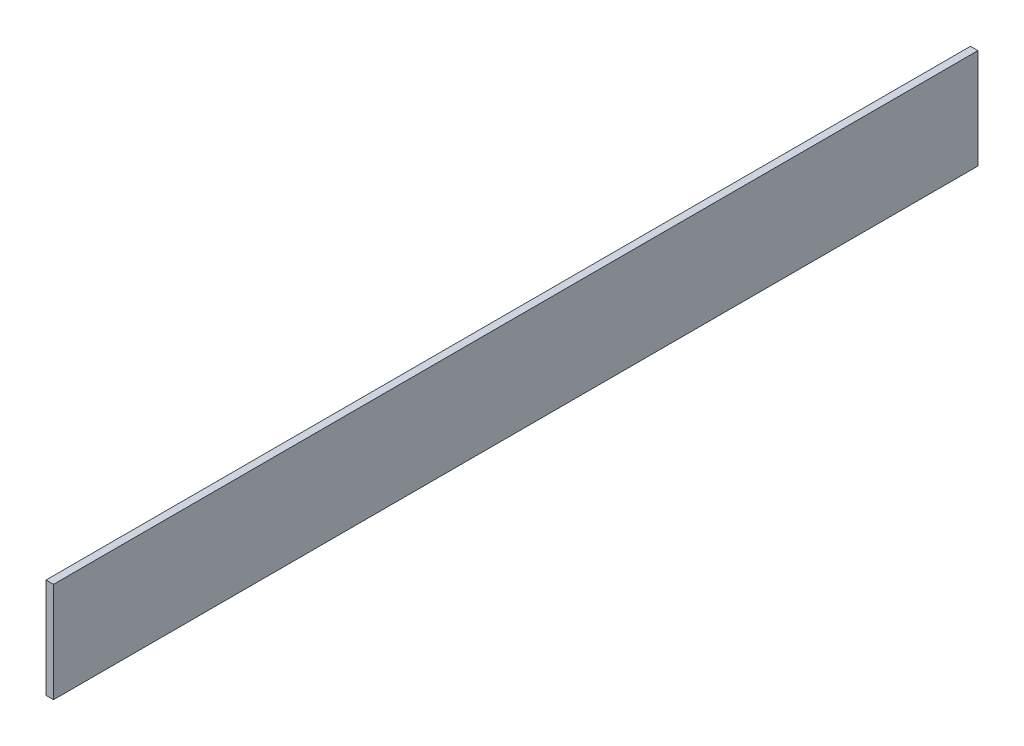
from build123d import *

# Parameters (mm, degrees)
SKETCH1_W           = 587.375
SKETCH1_H           = 63.5
BOSS_EXTRUDE1_DEPTH = 4.7625


with BuildPart() as part:
    # Sketch1 → Boss-Extrude1 (new body)
    with BuildSketch(Plane(origin=(0, 0, 0), x_dir=(0, 0, -1), z_dir=(1, 0, 0))):
        with Locations((293.6875, 31.75)):
            Rectangle(SKETCH1_W, SKETCH1_H)
    extrude(amount=BOSS_EXTRUDE1_DEPTH)


solid = part.part
